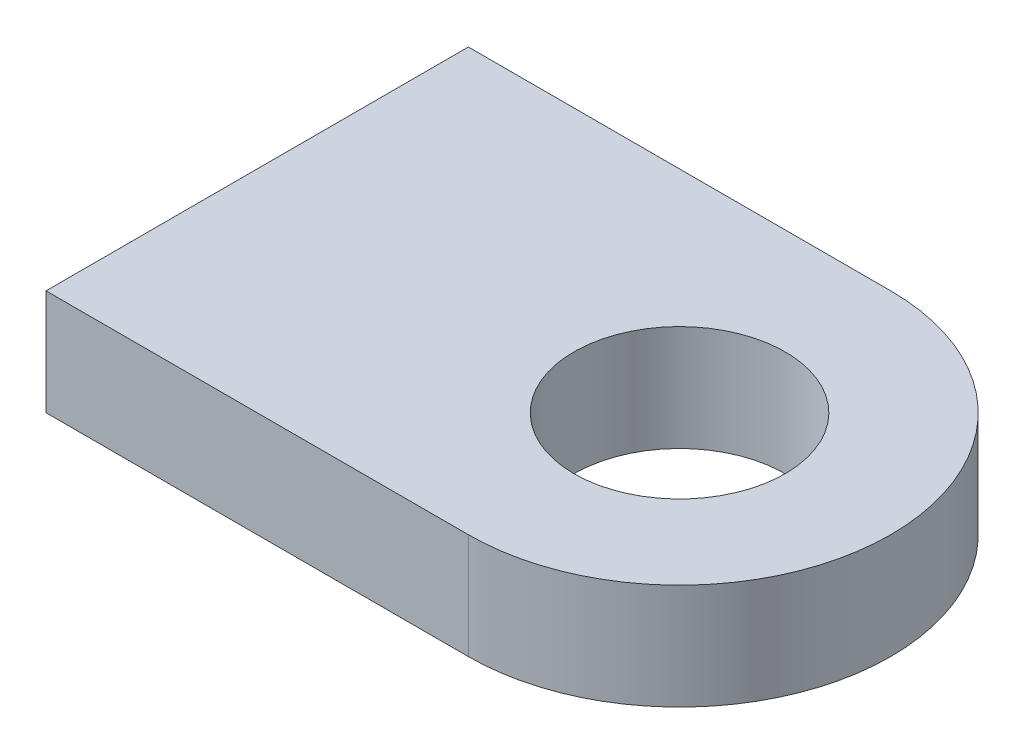
from build123d import *

# Parameters (mm, degrees)
SKETCH1_R           = 5
BOSS_EXTRUDE1_DEPTH = 5


with BuildPart() as part:
    # Sketch1 → Boss-Extrude1 (new body)
    with BuildSketch(Plane(origin=(0, 0, 0), x_dir=(1, 0, 0), z_dir=(0, 1, 0))):
        with BuildLine():
            Line((0, -10), (0, 10))
            Line((0, 10), (20, 10))
            ThreePointArc((20, 10), (30, 0), (20, -10))
            Line((20, -10), (0, -10))
        make_face()
        with Locations(Location((20, 0, 0), (0, 0, 270))):
            Circle(SKETCH1_R, mode=Mode.SUBTRACT)
    extrude(amount=BOSS_EXTRUDE1_DEPTH)


solid = part.part
